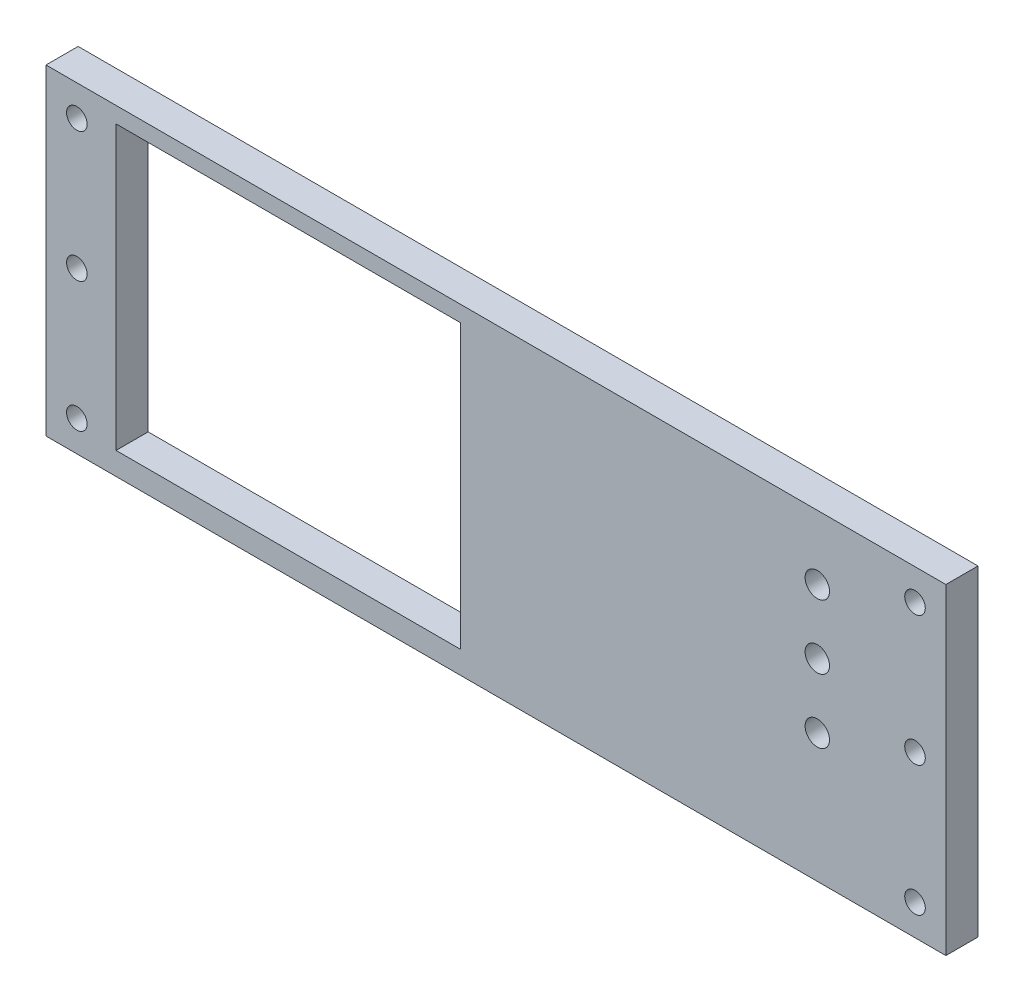
from build123d import *

# Parameters (mm, degrees)
SKETCH1_W           = 177.8
SKETCH1_H           = 63.5
SKETCH1_R           = 2.032
BOSS_EXTRUDE1_DEPTH = 6.35
CUT_EXTRUDE1_DEPTH  = 6.35
SKETCH3_R           = 2.413
CUT_EXTRUDE2_DEPTH  = 6.35
LPATTERN1_COUNT     = 3
LPATTERN1_PITCH     = 12.7


with BuildPart() as part:
    # Sketch1 → Boss-Extrude1 (new body)
    with BuildSketch(Plane.XY):
        Rectangle(SKETCH1_W, SKETCH1_H)
        with Locations((-82.804, 25.654)):
            Circle(SKETCH1_R, mode=Mode.SUBTRACT)
        with Locations((-82.804, 0)):
            Circle(SKETCH1_R, mode=Mode.SUBTRACT)
        with Locations((-82.804, -25.654)):
            Circle(SKETCH1_R, mode=Mode.SUBTRACT)
        with Locations((82.804, -25.654)):
            Circle(SKETCH1_R, mode=Mode.SUBTRACT)
        with Locations((82.804, 0)):
            Circle(SKETCH1_R, mode=Mode.SUBTRACT)
        with Locations((82.804, 25.654)):
            Circle(SKETCH1_R, mode=Mode.SUBTRACT)
    extrude(amount=BOSS_EXTRUDE1_DEPTH)

    # Sketch2 → Cut-Extrude1 (cut)
    with BuildSketch(Plane.XY.offset(6.35)):
        Polygon((-75.063183589, 28.589529071), (-75.063183589, -27.290470929), (-51.281087561, -27.290470929), (-50.94437734, 0.649529071), (-50.94437734, 28.589529071), align=None)
        Polygon((-50.94437734, 0.649529071), (-51.281087561, -27.290470929), (-7.031936064, -27.290470929), (-7.031936064, 28.589529071), (-50.94437734, 28.589529071), align=None)
    extrude(amount=-CUT_EXTRUDE1_DEPTH, mode=Mode.SUBTRACT)

    # Sketch3 → Cut-Extrude2 (cut)
    with BuildSketch(Plane.XY.offset(6.35)):
        with Locations((63.5, 19.05)):
            Circle(SKETCH3_R)
    cut_extrude2 = extrude(amount=-CUT_EXTRUDE2_DEPTH, mode=Mode.SUBTRACT)

    # LPattern1: Cut-Extrude2 ×3
    with Locations(*[(0, -i * LPATTERN1_PITCH, 0) for i in range(1, LPATTERN1_COUNT)]):
        add(cut_extrude2, mode=Mode.SUBTRACT)


solid = part.part
